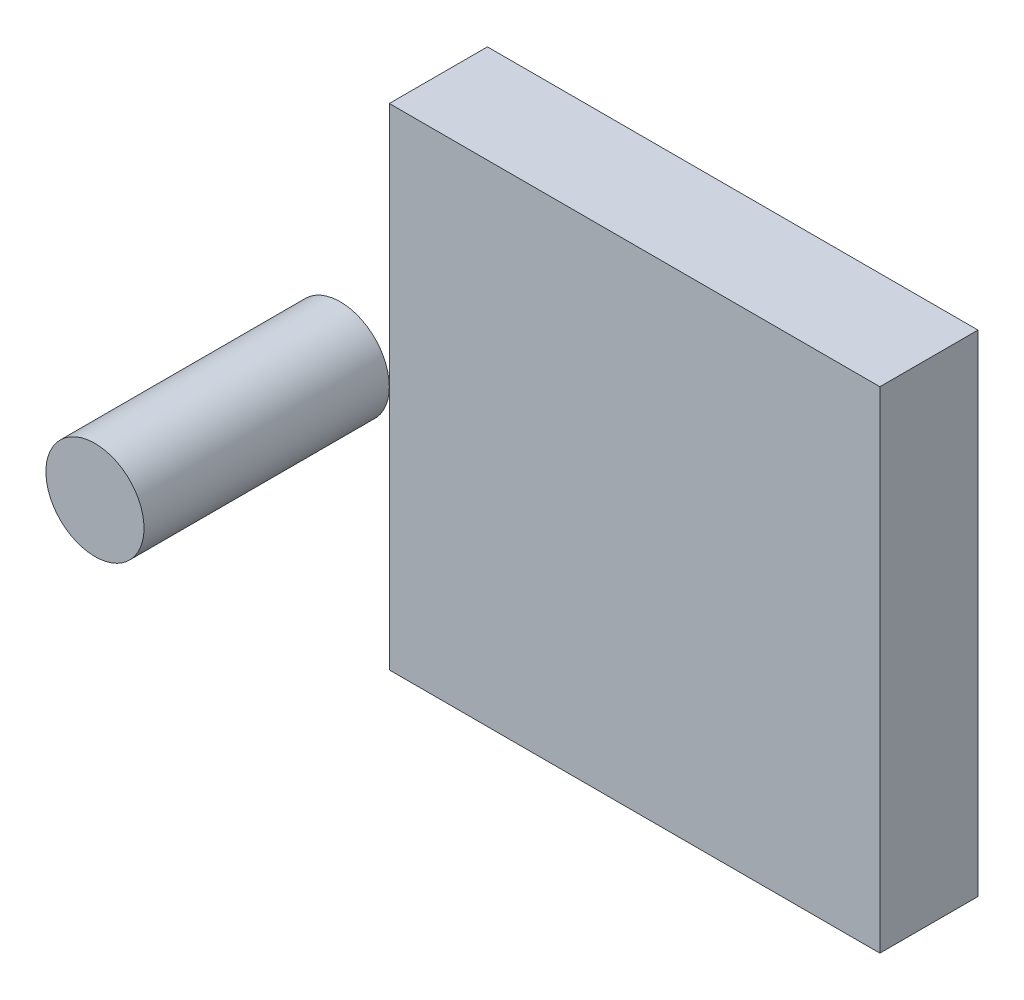
from build123d import *

# Parameters (mm, degrees)
SKETCH_1_W      = 100
SKETCH_1_H      = 100
EXTRUDE_1_DEPTH = 20
SKETCH_2_R      = 10
EXTRUDE_2_DEPTH = 50


with BuildPart() as part:
    # 草图1 → 凸台-拉伸1 (new body)
    with BuildSketch(Plane.XY):
        Rectangle(SKETCH_1_W, SKETCH_1_H)
    extrude(amount=EXTRUDE_1_DEPTH)


with BuildPart() as body_2:
    # 草图2 → 凸台-拉伸2 (new body)
    with BuildSketch(Plane.XY.offset(20)):
        with Locations((-60, 0)):
            Circle(SKETCH_2_R)
    extrude(amount=EXTRUDE_2_DEPTH)


solid = Compound([part.part, body_2.part])
